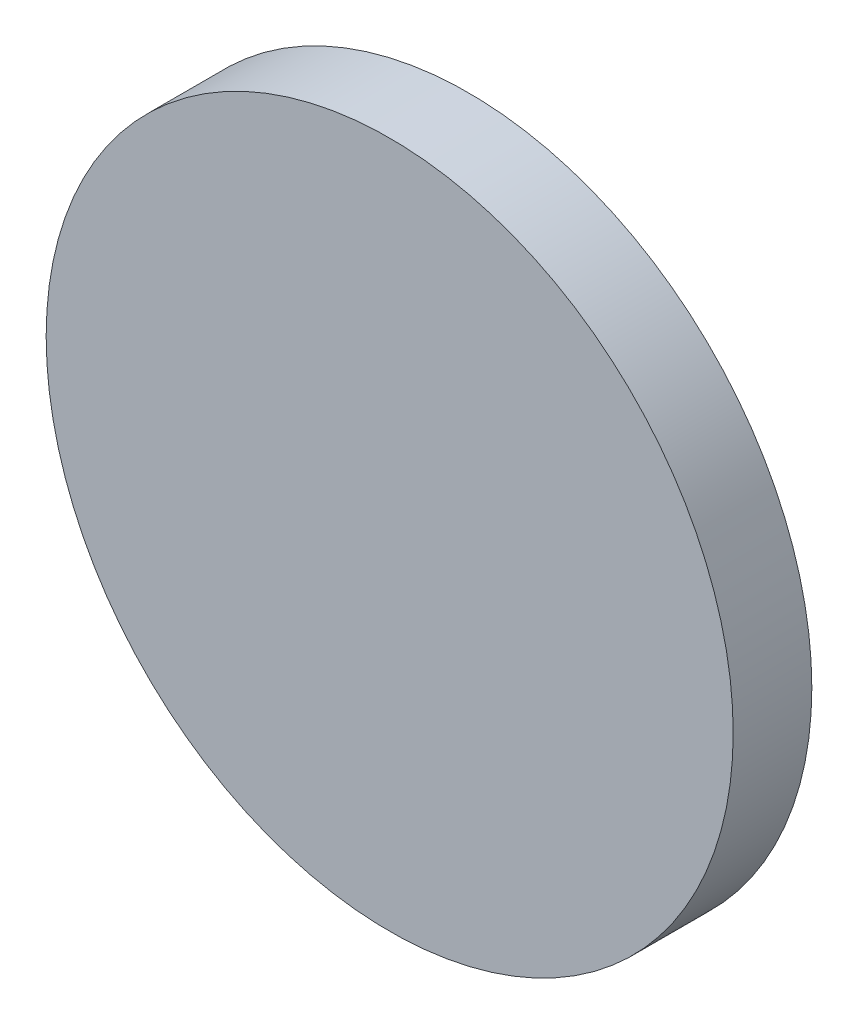
from build123d import *

# Parameters (mm, degrees)
SKETCH1_R           = 0.017473865
BOSS_EXTRUDE1_DEPTH = 0.004


with BuildPart() as part:
    # Sketch1 → Boss-Extrude1 (new body)
    with BuildSketch(Plane.XY):
        Circle(SKETCH1_R)
    extrude(amount=-BOSS_EXTRUDE1_DEPTH)


solid = part.part
